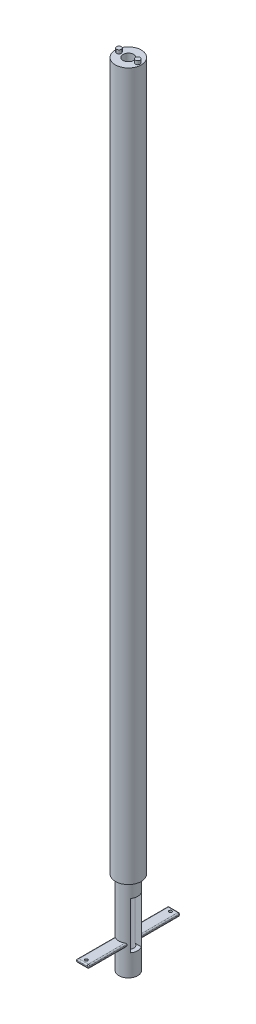
from build123d import *

# Parameters (mm, degrees)
SWEEP3_PROFILE_R         = 4
SWEEP4_PROFILE_R         = 5.5
SKETCH45_R               = 2.25
CUT_EXTRUDE2_DEPTH       = 337.377466094
SWEEP5_PROFILE_R         = 1
SWEEP6_PROFILE_R         = 1
SKETCH72_W               = 4.5
SKETCH72_H               = 20
CUT_EXTRUDE6_DEPTH       = 20
BOSS_EXTRUDE1_DEPTH      = 2.5
BOSS_EXTRUDE1_DEPTH_BACK = 2.5
BOSS_EXTRUDE3_DEPTH      = 2.5
BOSS_EXTRUDE3_DEPTH_BACK = 2.5
SKETCH76_4_W             = 16.5
SKETCH76_4_H             = 1.4
SKETCH77_R               = 0.612238256
CUT_EXTRUDE7_DEPTH       = 20
FILLET1_R                = 0.5


with BuildPart() as part:
    # Sweep3: sweep along a path in Sketch31
    with BuildLine(Plane.XY) as sweep3_path:
        Line((0, 0), (0, 35.470165431))
    # Sweep3 profile (on start of the path) → Sweep3 (sweep)
    with BuildSketch(Plane.ZX):
        Circle(SWEEP3_PROFILE_R)
    sweep(path=sweep3_path.line)

    # Sweep4: sweep along a path in Sketch38
    with BuildLine(Plane.XY) as sweep4_path:
        Line((0, 35.470165431), (0, 336.287525335))
    # Sweep4 profile (on start of the path) → Sweep4 (sweep)
    with BuildSketch(Plane.ZX.offset(35.470165431)):
        Circle(SWEEP4_PROFILE_R)
    sweep(path=sweep4_path.line)

    # Sketch45 → Cut-Extrude2 (cut, through all)
    with BuildSketch(Plane(origin=(0, 0, 0), x_dir=(1, 0, 0), z_dir=(0, 1, 0))):
        Circle(SKETCH45_R)
    extrude(amount=CUT_EXTRUDE2_DEPTH, mode=Mode.SUBTRACT)

    # Sweep5: sweep along a curve in space
    with BuildLine() as sweep5_path:
        Line((4, 336.287525335, 5.558e-06), (4, 337.787525335, 5.558e-06))
    # Sweep5 profile (on start of the path) → Sweep5 (sweep)
    with BuildSketch(Plane(origin=(4, 336.287525335, 5.558e-06), x_dir=(0, 0, 1), z_dir=(0, 1, 0))):
        Circle(SWEEP5_PROFILE_R)
    sweep(path=sweep5_path.line)

    # Sweep6: sweep along a curve in space
    with BuildLine() as sweep6_path:
        Line((-4, 336.287525335, 9.31e-07), (-4, 337.787525335, 9.31e-07))
    # Sweep6 profile (on start of the path) → Sweep6 (sweep)
    with BuildSketch(Plane(origin=(-4, 336.287525335, 9.31e-07), x_dir=(0, 0, 1), z_dir=(0, 1, 0))):
        Circle(SWEEP6_PROFILE_R)
    sweep(path=sweep6_path.line)

    # Sketch72 → Cut-Extrude6 (cut)
    with BuildSketch(Plane(origin=(0, 0, 0), x_dir=(0, 0, -1), z_dir=(1, 0, 0))):
        with Locations((-0.068000409, 19.236124066)):
            Rectangle(SKETCH72_W, SKETCH72_H)
    extrude(amount=CUT_EXTRUDE6_DEPTH, mode=Mode.SUBTRACT)

    # Sketch76 → Boss-Extrude1 (add, two sides: drawn at the far end of the back side and taken through both)
    with BuildSketch(Plane(origin=(0, 0, 0), x_dir=(0, 0, -1), z_dir=(1, 0, 0)).offset(-BOSS_EXTRUDE1_DEPTH_BACK)):
        Polygon((-3, 12.070165431), (-3, 12.770165431), (-19.5, 12.770165431), (-19.5, 12.370165431), (-19.5, 11.370165431), (-3, 11.370165431), align=None)
    extrude(amount=BOSS_EXTRUDE1_DEPTH + BOSS_EXTRUDE1_DEPTH_BACK)

    # Sketch76<4> → Boss-Extrude3 (add, two sides: drawn at the far end of the back side and taken through both)
    with BuildSketch(Plane(origin=(0, 0, 0), x_dir=(0, 0, -1), z_dir=(1, 0, 0)).offset(-BOSS_EXTRUDE3_DEPTH_BACK)):
        with Locations((11.25, 12.070165431)):
            Rectangle(SKETCH76_4_W, SKETCH76_4_H)
    extrude(amount=BOSS_EXTRUDE3_DEPTH + BOSS_EXTRUDE3_DEPTH_BACK)

    # Sketch77 → Cut-Extrude7 (cut)
    with BuildSketch(Plane(origin=(0, 0, 0), x_dir=(1, 0, 0), z_dir=(0, 1, 0))):
        with Locations((0, 17.9)):
            Circle(SKETCH77_R)
        with Locations((0, -17.9)):
            Circle(SKETCH77_R)
    extrude(amount=CUT_EXTRUDE7_DEPTH, mode=Mode.SUBTRACT)

    # Fillet1
    fillet1_edges = [part.edges().sort_by_distance(p)[0] for p in [
        (-2.5, 12.770165431, 11.3112495),
        (-2.5, 11.370165431, 11.3112495),
        (2.5, 12.070165431, 19.5),
        (0, 11.370165431, 19.5),
        (2.5, 11.370165431, 11.3112495),
        (2.5, 12.770165431, 11.3112495),
        (0, 12.770165431, 19.5),
        (-2.5, 11.370165431, -11.3112495),
        (-2.5, 12.770165431, -11.3112495),
        (0, 12.770165431, -19.5),
        (0, 11.370165431, -19.5),
        (2.5, 12.070165431, -19.5),
        (2.5, 11.370165431, -11.3112495),
        (2.5, 12.770165431, -11.3112495),
    ]]
    fillet(fillet1_edges, radius=FILLET1_R)


solid = part.part
